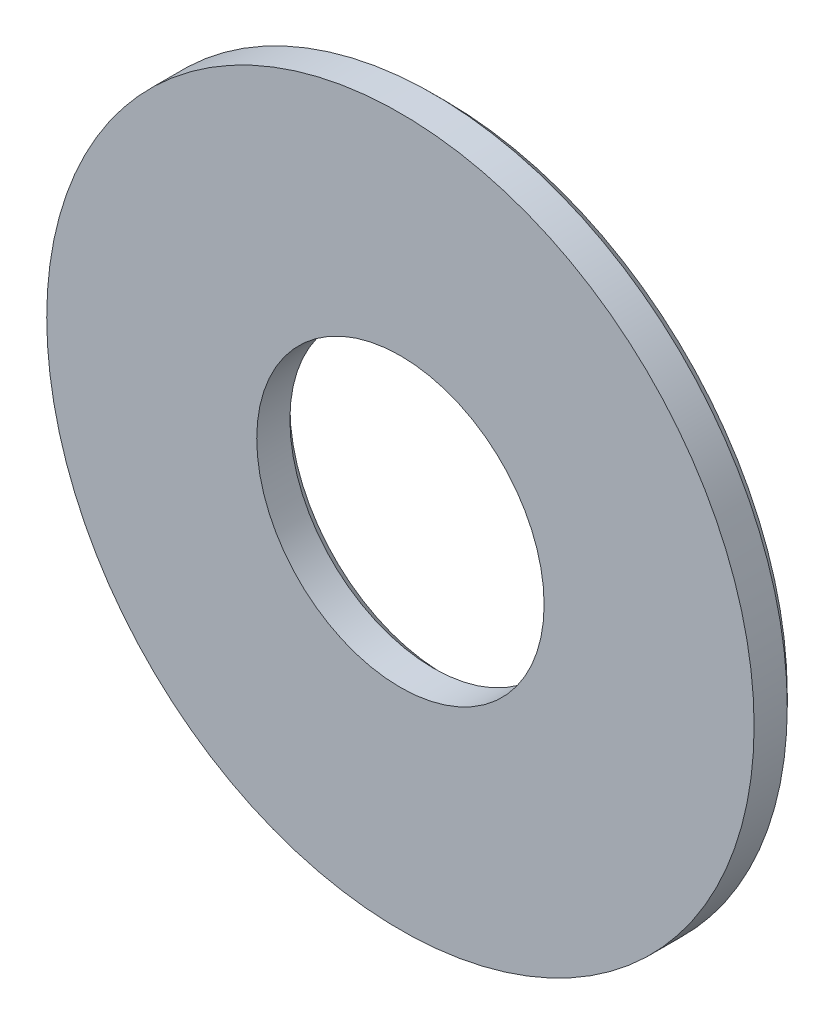
from build123d import *

# Parameters (mm, degrees)
SKETCH1_R           = 8
SKETCH1_R_2         = 3.25
BOSS_EXTRUDE1_DEPTH = 1
CHAMFER1_SIZE       = 0.25


with BuildPart() as part:
    # Sketch1 → Boss-Extrude1 (new body)
    with BuildSketch(Plane.XY):
        Circle(SKETCH1_R)
        Circle(SKETCH1_R_2, mode=Mode.SUBTRACT)
    extrude(amount=BOSS_EXTRUDE1_DEPTH)

    # Chamfer1
    chamfer1_edges = [part.edges().sort_by_distance(p)[0] for p in [
        (-8, 0, 0),
        (-3.25, 0, 0),
    ]]
    chamfer(chamfer1_edges, length=CHAMFER1_SIZE)


solid = part.part
